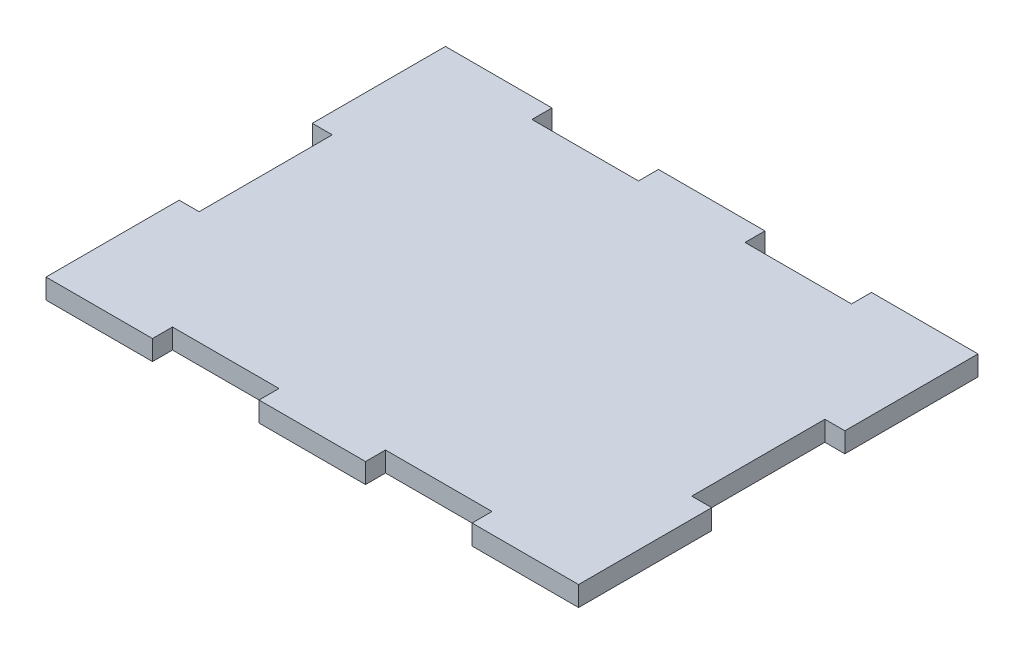
from build123d import *

# Parameters (mm, degrees)
TOP_AND_BOTTOM_EXTRUDED_DEPTH = 3


with BuildPart() as part:
    # Top and Bottom → Top and Bottom Extruded (new body)
    with BuildSketch(Plane(origin=(0, 0, 0), x_dir=(1, 0, 0), z_dir=(0, 1, 0))):
        Polygon((32, 60), (48, 60), (48, 57), (64, 57), (64, 60), (80, 60), (80, 40), (77, 40), (77, 20), (80, 20), (80, 0), (64, 0), (64, 3), (48, 3), (48, 0), (32, 0), (32, 3), (16, 3), (16, 0), (0, 0), (0, 20), (3, 20), (3, 40), (0, 40), (0, 60), (16, 60), (16, 57), (32, 57), align=None)
    extrude(amount=TOP_AND_BOTTOM_EXTRUDED_DEPTH)


solid = part.part
